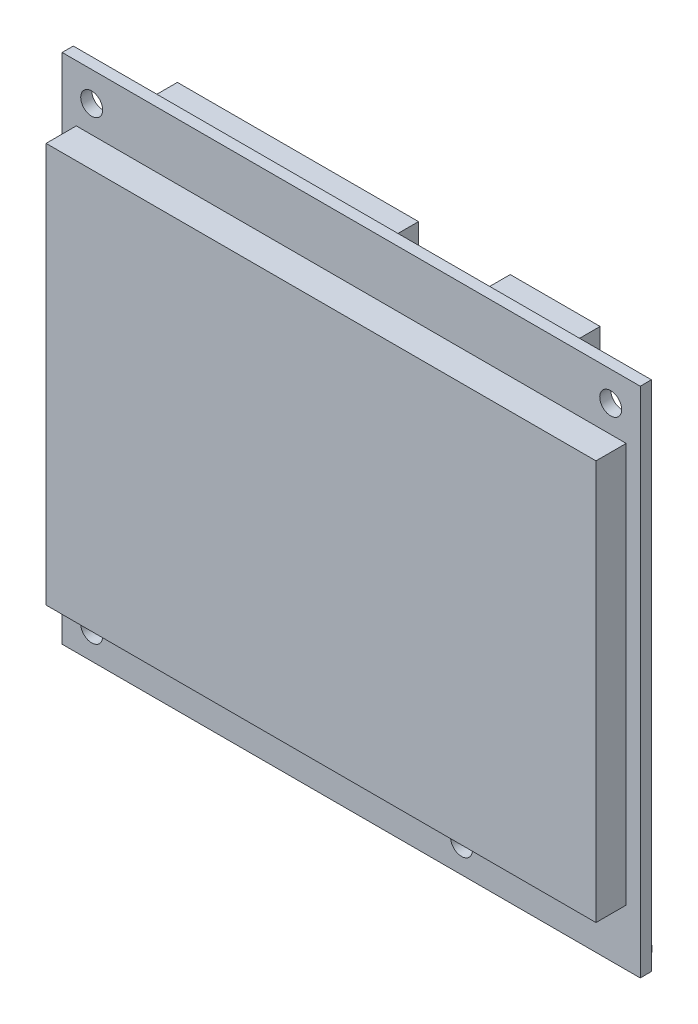
from build123d import *

# Parameters (mm, degrees)
SKETCH1_W           = 81.6864
SKETCH1_H           = 72.4154
BOSS_EXTRUDE1_DEPTH = 1.5748
SKETCH2_W           = 77.7
SKETCH2_H           = 56.5
BOSS_EXTRUDE2_DEPTH = 4.27
SKETCH4_R           = 1.55
CUT_EXTRUDE1_DEPTH  = 58.189442313
SKETCH3_W           = 12.7
SKETCH3_H           = 5.08
SKETCH3_W_2         = 34.071115987
BOSS_EXTRUDE3_DEPTH = 5.08
SKETCH5_W           = 11.143297124
SKETCH5_H           = 14.820585176
SKETCH5_W_2         = 5.702652661
SKETCH5_H_2         = 0.935331402
BOSS_EXTRUDE4_DEPTH = 1


with BuildPart() as part:
    # Sketch1 → Boss-Extrude1 (new body)
    with BuildSketch(Plane(origin=(0, 0, 0), x_dir=(-1, 0, 0), z_dir=(0, 0, -1))):
        with Locations((2.8568, -0.2173)):
            Rectangle(SKETCH1_W, SKETCH1_H)
    extrude(amount=BOSS_EXTRUDE1_DEPTH)

    # Sketch2 → Boss-Extrude2 (add)
    with BuildSketch(Plane(origin=(0, 0, 0), x_dir=(-1, 0, 0), z_dir=(0, 0, -1))):
        with Locations((2.85, -0.25)):
            Rectangle(SKETCH2_W, SKETCH2_H)
    extrude(amount=-BOSS_EXTRUDE2_DEPTH)

    # Sketch4 → Cut-Extrude1 (cut, through all)
    with BuildSketch(Plane(origin=(0, 0, -1.5748), x_dir=(-1, 0, 0), z_dir=(0, 0, -1))):
        with Locations((39.525, 31.8154)):
            Circle(SKETCH4_R)
        with Locations((39.525, -32.625)):
            Circle(SKETCH4_R)
        with Locations((-12.735, -32.625)):
            Circle(SKETCH4_R)
        with Locations((-33.8114, 31.8154)):
            Circle(SKETCH4_R)
    extrude(amount=-CUT_EXTRUDE1_DEPTH, mode=Mode.SUBTRACT)

    # Sketch3 → Boss-Extrude3 (add)
    with BuildSketch(Plane.XY.offset(-1.5748)):
        with Locations((19.31004682, 31.274104804)):
            Rectangle(SKETCH3_W, SKETCH3_H)
        with Locations((-17.035557993, 31.274104804)):
            Rectangle(SKETCH3_W_2, SKETCH3_H)
        with Locations((-17.035557993, -31.699250815)):
            Rectangle(SKETCH3_W_2, SKETCH3_H)
    extrude(amount=-BOSS_EXTRUDE3_DEPTH)

    # Sketch5 → Boss-Extrude4 (add)
    with BuildSketch(Plane(origin=(0, 0, -1.5748), x_dir=(-1, 0, 0), z_dir=(0, 0, -1))):
        Polygon((19.476551601, 13.535617464), (30.731281697, 2.280887368), (19.476551601, -8.973842728), (8.221821505, 2.280887368), align=None)
        with Locations((-21.419348846, -17.387032057)):
            Rectangle(SKETCH5_W, SKETCH5_H)
        with Locations((-34.20974354, -34.592993391)):
            Rectangle(SKETCH5_W_2, SKETCH5_H_2)
    extrude(amount=BOSS_EXTRUDE4_DEPTH)


solid = part.part
